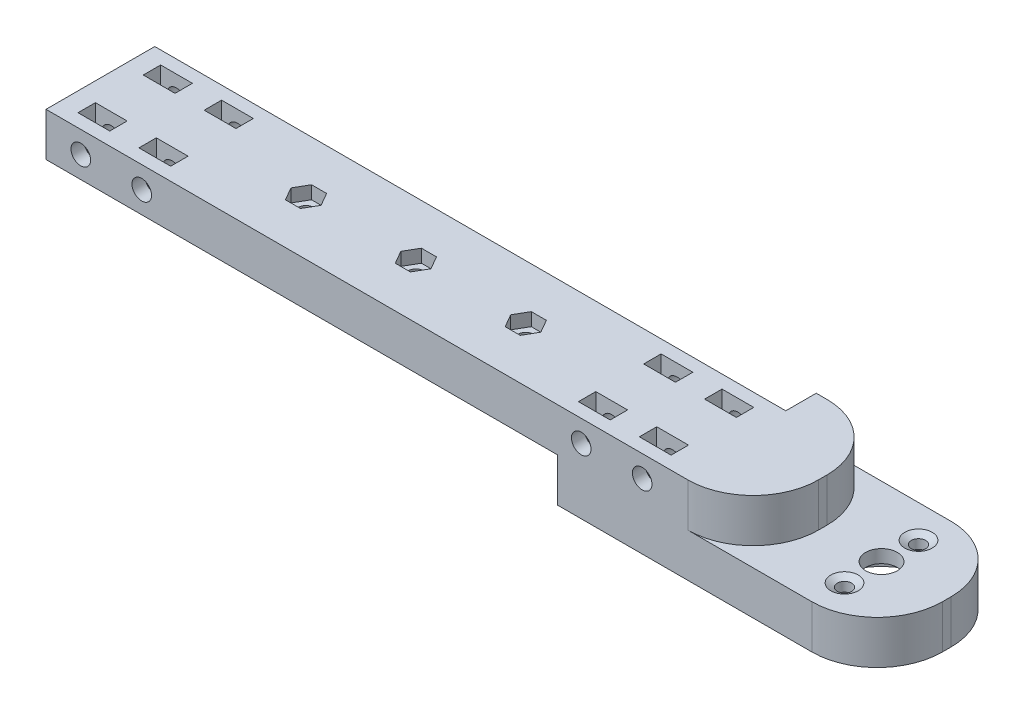
from build123d import *

# Parameters (mm, degrees)
SKETCH1_W           = 145
SKETCH1_H           = 25
BOSS_EXTRUDE1_DEPTH = 10
SKETCH2_W           = 17.5
SKETCH2_H           = 32
BOSS_EXTRUDE2_DEPTH = 10
SKETCH4_W           = 73.5
SKETCH4_H           = 32
BOSS_EXTRUDE3_DEPTH = 10
SKETCH8_R           = 2.25
CUT_EXTRUDE5_DEPTH  = 193.888568868
SKETCH9_W           = 7.3
SKETCH9_H           = 4
CUT_EXTRUDE6_DEPTH  = 10
CUT_EXTRUDE7_REACH  = 195.92
SKETCH10_R          = 3.65
SKETCH11_R          = 12.75
CUT_EXTRUDE8_DEPTH  = 7
CUT_EXTRUDE9_REACH  = 196.692
SKETCH12_R          = 1.75
CUT_EXTRUDE10_DEPTH = 3
CUT_EXTRUDE11_REACH = 196.098
SKETCH14_R          = 1.65
CHAMFER1_SIZE       = 1.5
CHAMFER1_SIZE2      = 0.866025404
FILLET1_R           = 15


with BuildPart() as part:
    # Sketch1 → Boss-Extrude1 (new body)
    with BuildSketch(Plane(origin=(0, 0, 0), x_dir=(1, 0, 0), z_dir=(0, 1, 0))):
        with Locations((72.5, 12.5)):
            Rectangle(SKETCH1_W, SKETCH1_H)
    extrude(amount=BOSS_EXTRUDE1_DEPTH)

    # Sketch2 → Boss-Extrude2 (add)
    with BuildSketch(Plane(origin=(0, 10, 0), x_dir=(1, 0, 0), z_dir=(0, 1, 0))):
        with Locations((153.75, 16)):
            Rectangle(SKETCH2_W, SKETCH2_H)
    extrude(amount=-BOSS_EXTRUDE2_DEPTH)

    # Sketch4 → Boss-Extrude3 (add)
    with BuildSketch(Plane.XZ):
        with Locations((154.25, -16)):
            Rectangle(SKETCH4_W, SKETCH4_H)
    extrude(amount=BOSS_EXTRUDE3_DEPTH)

    # Sketch8 → Cut-Extrude5 (cut, through all)
    with BuildSketch(Plane(origin=(0, 0, -25), x_dir=(-1, 0, 0), z_dir=(0, 0, -1))):
        with Locations((-137, 5)):
            Circle(SKETCH8_R)
        with Locations((-123, 5)):
            Circle(SKETCH8_R)
        with Locations(Location((-22, 5, 0), (0, 0, 180))):
            Circle(SKETCH8_R)
        with Locations(Location((-8, 5, 0), (0, 0, 180))):
            Circle(SKETCH8_R)
    extrude(amount=-CUT_EXTRUDE5_DEPTH, mode=Mode.SUBTRACT)

    # Sketch9 → Cut-Extrude6 (cut)
    with BuildSketch(Plane(origin=(0, 10, 0), x_dir=(1, 0, 0), z_dir=(0, 1, 0))):
        with Locations((137, 20)):
            Rectangle(SKETCH9_W, SKETCH9_H)
        with Locations((137, 5)):
            Rectangle(SKETCH9_W, SKETCH9_H)
        with Locations((123, 5)):
            Rectangle(SKETCH9_W, SKETCH9_H)
        with Locations((123, 20)):
            Rectangle(SKETCH9_W, SKETCH9_H)
        with Locations((8, 20)):
            Rectangle(SKETCH9_W, SKETCH9_H)
        with Locations((22, 20)):
            Rectangle(SKETCH9_W, SKETCH9_H)
        with Locations((22, 5)):
            Rectangle(SKETCH9_W, SKETCH9_H)
        with Locations((8, 5)):
            Rectangle(SKETCH9_W, SKETCH9_H)
    extrude(amount=-CUT_EXTRUDE6_DEPTH, mode=Mode.SUBTRACT)

    # Sketch10 → Cut-Extrude7 (cut, up to next)
    with BuildSketch(Plane(origin=(0, 0, 0), x_dir=(1, 0, 0), z_dir=(0, 1, 0)), mode=Mode.PRIVATE) as cut_extrude7_sk1:
        with Locations(Location((176, 16, 0), (0, 0, 270))):
            Circle(SKETCH10_R)
    cut_extrude7_tool1 = extrude(cut_extrude7_sk1.sketch, amount=-CUT_EXTRUDE7_REACH, mode=Mode.PRIVATE) & part.part
    add(cut_extrude7_tool1.solids().sort_by_distance((176, 0, -16))[0], mode=Mode.SUBTRACT)

    # Sketch11 → Cut-Extrude8 (cut)
    with BuildSketch(Plane.XZ.offset(10)):
        with Locations(Location((176, -16, 0), (0, 0, 270))):
            Circle(SKETCH11_R)
    extrude(amount=-CUT_EXTRUDE8_DEPTH, mode=Mode.SUBTRACT)

    # Sketch12 → Cut-Extrude9 (cut, up to next)
    with BuildSketch(Plane(origin=(0, 10, 0), x_dir=(1, 0, 0), z_dir=(0, 1, 0)), mode=Mode.PRIVATE) as cut_extrude9_sk1:
        with Locations(Location((47.25, 12.5, 0), (0, 0, 270))):
            Circle(SKETCH12_R)
    cut_extrude9_tool1 = extrude(cut_extrude9_sk1.sketch, amount=-CUT_EXTRUDE9_REACH, mode=Mode.PRIVATE) & part.part
    # Sketch12 → Cut-Extrude9 (cut, up to next)
    with BuildSketch(Plane(origin=(0, 10, 0), x_dir=(1, 0, 0), z_dir=(0, 1, 0)), mode=Mode.PRIVATE) as cut_extrude9_sk2:
        with Locations(Location((72.5, 12.5, 0), (0, 0, 270))):
            Circle(SKETCH12_R)
    cut_extrude9_tool2 = extrude(cut_extrude9_sk2.sketch, amount=-CUT_EXTRUDE9_REACH, mode=Mode.PRIVATE) & part.part
    # Sketch12 → Cut-Extrude9 (cut, up to next)
    with BuildSketch(Plane(origin=(0, 10, 0), x_dir=(1, 0, 0), z_dir=(0, 1, 0)), mode=Mode.PRIVATE) as cut_extrude9_sk3:
        with Locations(Location((97.75, 12.5, 0), (0, 0, 270))):
            Circle(SKETCH12_R)
    cut_extrude9_tool3 = extrude(cut_extrude9_sk3.sketch, amount=-CUT_EXTRUDE9_REACH, mode=Mode.PRIVATE) & part.part
    add(cut_extrude9_tool1.solids().sort_by_distance((47.25, 10, -12.5))[0], mode=Mode.SUBTRACT)
    add(cut_extrude9_tool2.solids().sort_by_distance((72.5, 10, -12.5))[0], mode=Mode.SUBTRACT)
    add(cut_extrude9_tool3.solids().sort_by_distance((97.75, 10, -12.5))[0], mode=Mode.SUBTRACT)

    # Sketch13 → Cut-Extrude10 (cut)
    with BuildSketch(Plane(origin=(0, 10, 0), x_dir=(1, 0, 0), z_dir=(0, 1, 0))):
        Polygon((75.964101615, 12.5), (74.232050808, 15.5), (70.767949192, 15.5), (69.035898385, 12.5), (70.767949192, 9.5), (74.232050808, 9.5), align=None)
        Polygon((50.714101615, 12.5), (48.982050808, 15.5), (45.517949192, 15.5), (43.785898385, 12.5), (45.517949192, 9.5), (48.982050808, 9.5), align=None)
        Polygon((101.214101615, 12.5), (99.482050808, 15.5), (96.017949192, 15.5), (94.285898385, 12.5), (96.017949192, 9.5), (99.482050808, 9.5), align=None)
    extrude(amount=-CUT_EXTRUDE10_DEPTH, mode=Mode.SUBTRACT)

    # Sketch14 → Cut-Extrude11 (cut, up to next)
    with BuildSketch(Plane.XZ.offset(3), mode=Mode.PRIVATE) as cut_extrude11_sk1:
        with Locations(Location((176, -7.5, 0), (0, 0, 270))):
            Circle(SKETCH14_R)
    cut_extrude11_tool1 = extrude(cut_extrude11_sk1.sketch, amount=-CUT_EXTRUDE11_REACH, mode=Mode.PRIVATE) & part.part
    # Sketch14 → Cut-Extrude11 (cut, up to next)
    with BuildSketch(Plane.XZ.offset(3), mode=Mode.PRIVATE) as cut_extrude11_sk2:
        with Locations(Location((176, -24.5, 0), (0, 0, 270))):
            Circle(SKETCH14_R)
    cut_extrude11_tool2 = extrude(cut_extrude11_sk2.sketch, amount=-CUT_EXTRUDE11_REACH, mode=Mode.PRIVATE) & part.part
    add(cut_extrude11_tool1.solids().sort_by_distance((176, -3, -7.5))[0], mode=Mode.SUBTRACT)
    add(cut_extrude11_tool2.solids().sort_by_distance((176, -3, -24.5))[0], mode=Mode.SUBTRACT)

    # Chamfer1
    chamfer1_edges = [part.edges().sort_by_distance(p)[0] for p in [
        (176, 0, -5.85),
        (176, 0, -22.85),
    ]]
    chamfer1_side = [part.faces().sort_by_distance(p)[0] for p in [
        (162.928514877, 0, -16),
    ]]
    chamfer(chamfer1_edges, length=CHAMFER1_SIZE, length2=CHAMFER1_SIZE2, reference=chamfer1_side[0])

    # Fillet1
    fillet1_edges = [part.edges().sort_by_distance(p)[0] for p in [
        (162.5, 5, -32),
        (162.5, 5, 0),
        (191, -5, -32),
        (191, -5, 0),
    ]]
    fillet(fillet1_edges, radius=FILLET1_R)


solid = part.part
